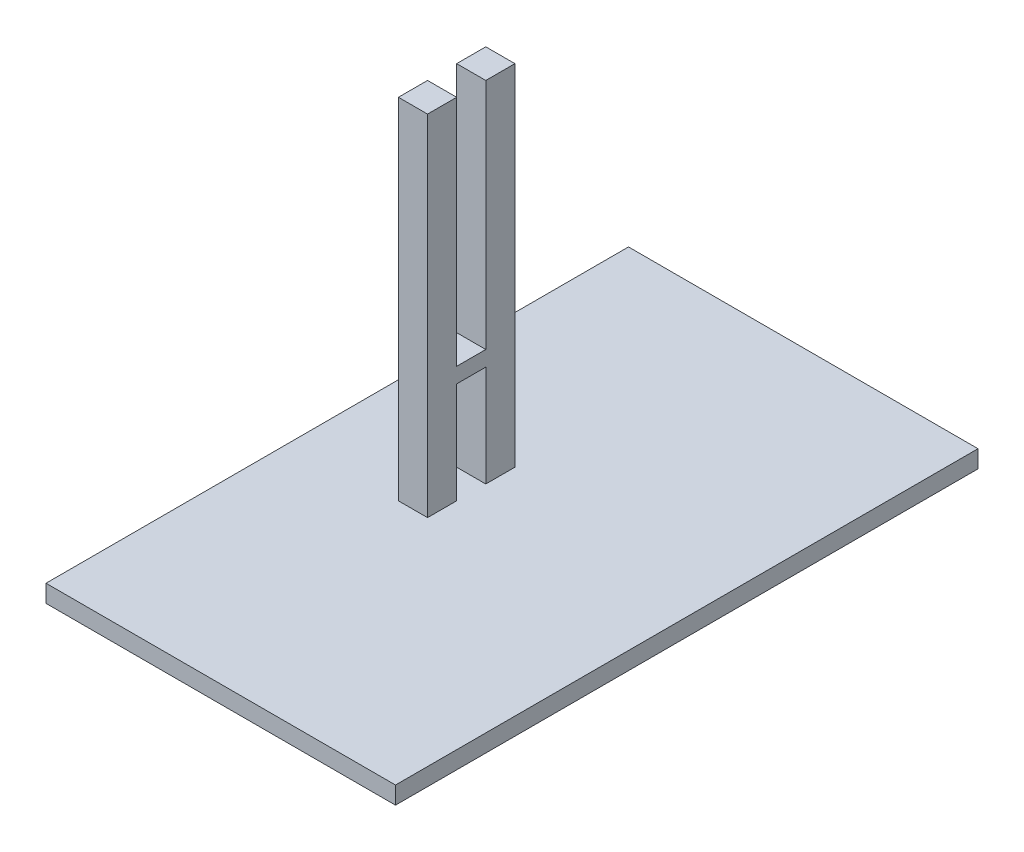
from build123d import *

# Parameters (mm, degrees)
SKETCH1_W           = 60
SKETCH1_H           = 100
BOSS_EXTRUDE1_DEPTH = 3
BOSS_EXTRUDE2_DEPTH = 60
BOSS_EXTRUDE3_START = -5
SKETCH3_W           = 5
SKETCH3_H           = 2.614864802
BOSS_EXTRUDE3_DEPTH = 5


with BuildPart() as part:
    # Sketch1 → Boss-Extrude1 (new body)
    with BuildSketch(Plane(origin=(0, 0, 0), x_dir=(1, 0, 0), z_dir=(0, 1, 0))):
        Rectangle(SKETCH1_W, SKETCH1_H)
    extrude(amount=BOSS_EXTRUDE1_DEPTH)

    # Sketch2 → Boss-Extrude2 (add)
    with BuildSketch(Plane(origin=(0, 3, 0), x_dir=(1, 0, 0), z_dir=(0, 1, 0))):
        Polygon((-9.5, 2.5), (-7, 2.5), (-7, 7.5), (-12, 7.5), (-12, 2.5), align=None)
        Polygon((-9.5, -2.5), (-7, -2.5), (-7, -7.5), (-12, -7.5), (-12, -2.5), align=None)
    extrude(amount=BOSS_EXTRUDE2_DEPTH)

    # Sketch3 → Boss-Extrude3 (add)
    with BuildSketch(Plane(origin=(-7, 0, 0), x_dir=(0, 0, -1), z_dir=(1, 0, 0)).offset(BOSS_EXTRUDE3_START)):
        with Locations((0, 21.692567599)):
            Rectangle(SKETCH3_W, SKETCH3_H)
    extrude(amount=BOSS_EXTRUDE3_DEPTH)


solid = part.part
